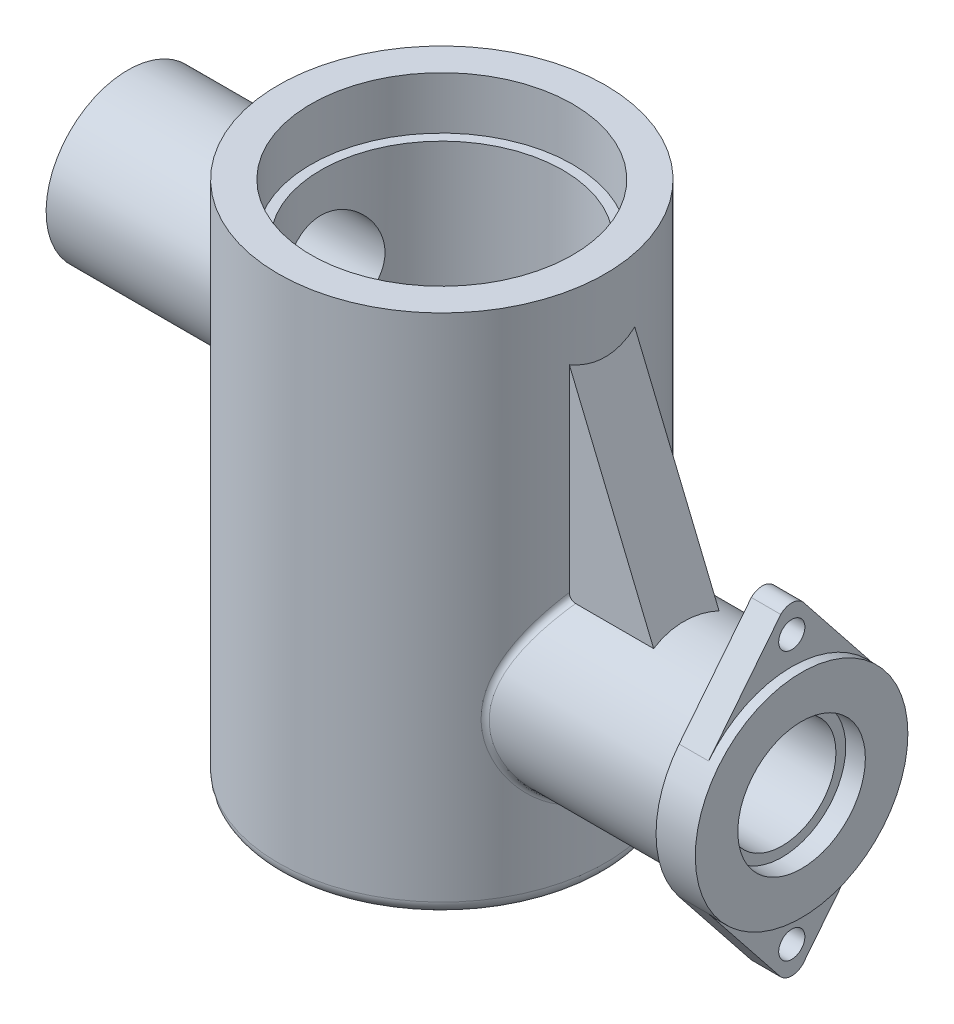
from build123d import *

# Parameters (mm, degrees)
SKETCH2_R             = 2
BOSS_EXTRUDE1_DEPTH   = 4.5
BOSS_EXTRUDE1_2_DEPTH = 4.5
SKETCH2_3_R           = 9.75
BOSS_EXTRUDE2_DEPTH   = 6
SKETCH2_4_R           = 9.75
BOSS_EXTRUDE3_DEPTH   = 6
SKETCH3_R             = 9.75
SKETCH3_R_2           = 8.25
CUT_EXTRUDE1_DEPTH    = 3
SKETCH3_3_R           = 8.25
CUT_EXTRUDE2_DEPTH    = 6
BOSS_EXTRUDE4_REACH   = 117.438
SKETCH5_R             = 14
CUT_EXTRUDE3_REACH    = 117.438
SKETCH6_R             = 8.25
FILLET1_R             = 1
BOSS_EXTRUDE5_REACH   = 137.864
SKETCH7_R             = 12.5
SKETCH7_R_2           = 8
CUT_EXTRUDE4_REACH    = 137.864
SKETCH8_R             = 8
FILLET2_R             = 2
RIB1_REACH            = 106.283
SKETCH9_WALL_W        = 241.95124601
SKETCH9_WALL_H        = 10


with BuildPart() as part:
    # Sketch1 → Revolve1 (revolve)
    with BuildSketch(Plane.XY):
        with BuildLine():
            Line((9.5, 0), (16, 0))
            Line((16, 0), (16, 3))
            ThreePointArc((16, 3), (16.585786438, 4.414213562), (18, 5))
            Line((18, 5), (23, 5))
            ThreePointArc((23, 5), (24.414213562, 5.585786438), (25, 7))
            Line((25, 7), (25, 85))
            Line((25, 85), (20, 85))
            Line((20, 85), (20, 77))
            Line((20, 77), (18.5, 77))
            Line((18.5, 77), (18.5, 54))
            ThreePointArc((18.5, 54), (18.207106781, 53.292893219), (17.5, 53))
            Line((17.5, 53), (14.5, 53))
            Line((14.5, 53), (14.5, 49.5))
            Line((14.5, 49.5), (9.5, 49.5))
            Line((9.5, 49.5), (9.5, 46.5))
            Line((9.5, 46.5), (17.5, 46.5))
            ThreePointArc((17.5, 46.5), (18.207106781, 46.207106781), (18.5, 45.5))
            Line((18.5, 45.5), (18.5, 13))
            ThreePointArc((18.5, 13), (17.914213562, 11.585786438), (16.5, 11))
            Line((16.5, 11), (9.5, 11))
            Line((9.5, 11), (9.5, 0))
        make_face()
    revolve(axis=Axis((0, 0, 0), (0, 1, 0)))

    # Sketch5 → Boss-Extrude4 (add, up to next)
    with BuildSketch(Plane.ZY.offset(-49), mode=Mode.PRIVATE) as boss_extrude4_sk1:
        with Locations((0, 31)):
            Circle(SKETCH5_R)
    boss_extrude4_tool1 = extrude(boss_extrude4_sk1.sketch, amount=BOSS_EXTRUDE4_REACH, mode=Mode.PRIVATE) - part.part


with BuildPart() as body_2:
    # Sketch2 → Boss-Extrude1 (new body)
    with BuildSketch(Plane(origin=(49, 0, 0), x_dir=(0, 0, -1), z_dir=(1, 0, 0))):
        with BuildLine():
            Line((1.679648576, 7), (12.720152314, 20.887620205))
            ThreePointArc((12.720152314, 20.887620205), (-3.4e-08, 14.75), (-12.720152356, 20.887620258))
            Line((-12.720152356, 20.887620258), (-1.679648576, 7))
            ThreePointArc((-1.679648576, 7), (0, 6.30426678), (1.679648576, 7))
        make_face()
        with Locations((0, 10.5)):
            Circle(SKETCH2_R, mode=Mode.SUBTRACT)
    extrude(amount=BOSS_EXTRUDE1_DEPTH)



with BuildPart() as body_3:
    # Sketch2 → Boss-Extrude1 2 (new body)
    with BuildSketch(Plane(origin=(49, 0, 0), x_dir=(0, 0, -1), z_dir=(1, 0, 0))):
        with BuildLine():
            Line((-1.679648576, 55), (-12.720152171, 41.112379975))
            ThreePointArc((-12.720152171, 41.112379975), (2.38e-07, 47.25), (12.720152467, 41.112379602))
            Line((12.720152467, 41.112379602), (1.679648576, 55))
            ThreePointArc((1.679648576, 55), (0, 55.69573322), (-1.679648576, 55))
        make_face()
        with Locations((0, 51.5)):
            Circle(SKETCH2_R, mode=Mode.SUBTRACT)
    extrude(amount=BOSS_EXTRUDE1_2_DEPTH)


with BuildPart() as body_2_1:
    add(body_2.part)

    add(body_3.part)  # Boss-Extrude2 merges body 3
    # Sketch2<3> → Boss-Extrude2 (add)
    with BuildSketch(Plane(origin=(49, 0, 0), x_dir=(0, 0, -1), z_dir=(1, 0, 0))):
        with BuildLine():
            ThreePointArc((-12.720152356, 20.887620258), (-3.4e-08, 14.75), (12.720152314, 20.887620205))
            ThreePointArc((12.720152314, 20.887620205), (15.342180013, 25.644627702), (16.25, 31))
            ThreePointArc((16.25, 31), (15.342180053, 36.355372182), (12.720152467, 41.112379602))
            ThreePointArc((12.720152467, 41.112379602), (2.38e-07, 47.25), (-12.720152171, 41.112379975))
            ThreePointArc((-12.720152171, 41.112379975), (-16.25, 31.000000149), (-12.720152356, 20.887620258))
        make_face()
        with Locations((0, 31)):
            Circle(SKETCH2_3_R, mode=Mode.SUBTRACT)
    extrude(amount=BOSS_EXTRUDE2_DEPTH)

    # Sketch2<4> → Boss-Extrude3 (add)
    with BuildSketch(Plane(origin=(49, 0, 0), x_dir=(0, 0, -1), z_dir=(1, 0, 0))):
        with Locations((0, 31)):
            Circle(SKETCH2_4_R)
    extrude(amount=BOSS_EXTRUDE3_DEPTH)

    # Sketch3 → Cut-Extrude1 (cut)
    with BuildSketch(Plane(origin=(55, 0, 0), x_dir=(0, 0, -1), z_dir=(1, 0, 0))):
        with Locations((0, 31)):
            Circle(SKETCH3_R)
        with Locations((0, 31)):
            Circle(SKETCH3_R_2, mode=Mode.SUBTRACT)
    extrude(amount=-CUT_EXTRUDE1_DEPTH, mode=Mode.SUBTRACT)

    # Sketch3<3> → Cut-Extrude2 (cut)
    with BuildSketch(Plane(origin=(55, 0, 0), x_dir=(0, 0, -1), z_dir=(1, 0, 0))):
        with Locations((0, 31)):
            Circle(SKETCH3_3_R)
    extrude(amount=-CUT_EXTRUDE2_DEPTH, mode=Mode.SUBTRACT)


with BuildPart() as part_1:
    add(part.part)

    add(body_2_1.part)  # Boss-Extrude4 merges body 2
    add(boss_extrude4_tool1.solids().sort_by_distance((49, 31, 0))[0])

    # Sketch6 → Cut-Extrude3 (cut, up to next)
    with BuildSketch(Plane(origin=(49, 0, 0), x_dir=(0, 0, -1), z_dir=(1, 0, 0)), mode=Mode.PRIVATE) as cut_extrude3_sk1:
        with Locations((0, 31)):
            Circle(SKETCH6_R)
    cut_extrude3_tool1 = extrude(cut_extrude3_sk1.sketch, amount=-CUT_EXTRUDE3_REACH, mode=Mode.PRIVATE) & part_1.part
    add(cut_extrude3_tool1.solids().sort_by_distance((49, 31, 0))[0], mode=Mode.SUBTRACT)

    # Fillet1
    fillet1_edges = [part_1.edges().sort_by_distance(p)[0] for p in [
        (22.950672897, 21.113980233, 9.912951767),
        (49, 31, -14),
    ]]
    fillet(fillet1_edges, radius=FILLET1_R)

    # Sketch7 → Boss-Extrude5 (add, up to next)
    with BuildSketch(Plane(origin=(-48, 0, 0), x_dir=(0, 0, -1), z_dir=(1, 0, 0)), mode=Mode.PRIVATE) as boss_extrude5_sk1:
        with Locations((0, 63)):
            Circle(SKETCH7_R)
        with Locations((0, 63)):
            Circle(SKETCH7_R_2, mode=Mode.SUBTRACT)
    boss_extrude5_tool1 = extrude(boss_extrude5_sk1.sketch, amount=BOSS_EXTRUDE5_REACH, mode=Mode.PRIVATE) - part_1.part
    add(boss_extrude5_tool1.solids().sort_by_distance((-48, 63, 12.146447))[0])

    # Sketch8 → Cut-Extrude4 (cut, up to next)
    with BuildSketch(Plane.ZY.offset(48), mode=Mode.PRIVATE) as cut_extrude4_sk1:
        with Locations((0, 63)):
            Circle(SKETCH8_R)
    cut_extrude4_tool1 = extrude(cut_extrude4_sk1.sketch, amount=-CUT_EXTRUDE4_REACH, mode=Mode.PRIVATE) & part_1.part
    add(cut_extrude4_tool1.solids().sort_by_distance((-48, 63, 0))[0], mode=Mode.SUBTRACT)

    # Fillet2
    fillet2_edges = [part_1.edges().sort_by_distance(p)[0] for p in [
        (-21.650635095, 63, 12.5),
    ]]
    fillet(fillet2_edges, radius=FILLET2_R)

    # Sketch9 wall → Rib1 (add, up to next)
    with BuildSketch(Plane(origin=(31, 59.5, 0), x_dir=(0.382351792726, -0.924016832422, 0), z_dir=(0.924016832422, 0.382351792726, 0)), mode=Mode.PRIVATE) as rib1_sk1:
        Rectangle(SKETCH9_WALL_W, SKETCH9_WALL_H)
    rib1_tool1 = extrude(rib1_sk1.sketch, amount=-RIB1_REACH, mode=Mode.PRIVATE) - part_1.part
    add(rib1_tool1.solids().sort_by_distance((31, 59.5, 0))[0])


solid = part_1.part
